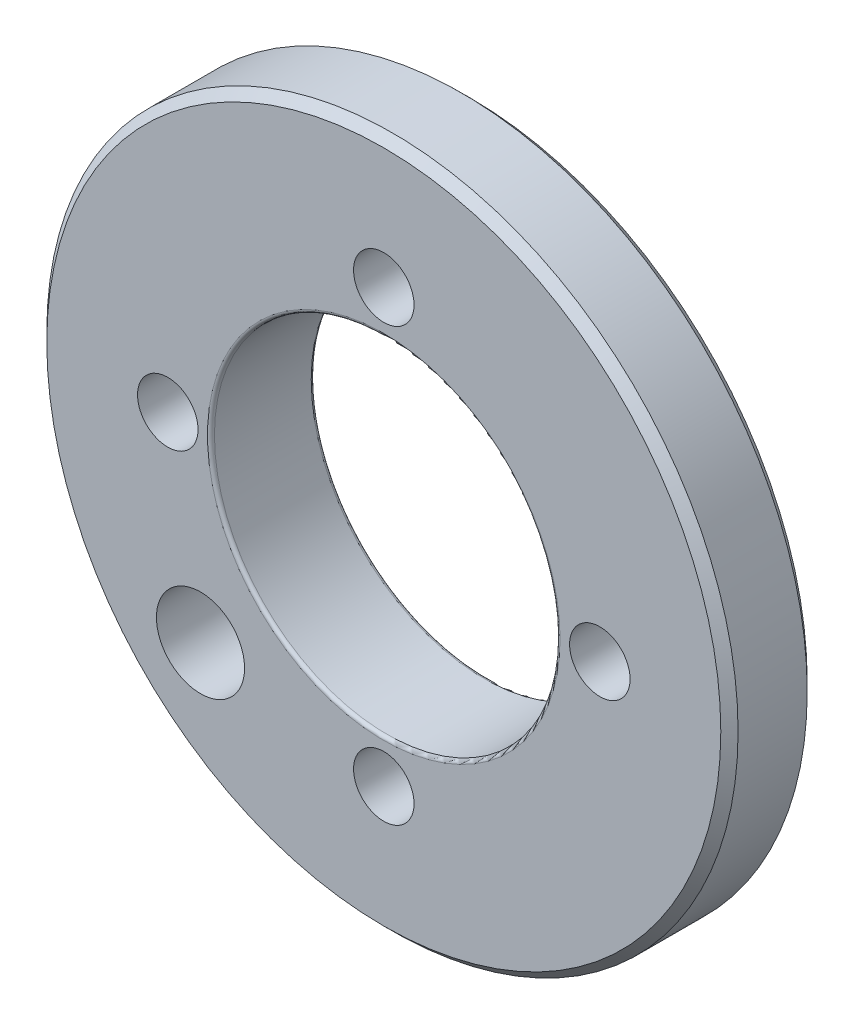
from build123d import *

# Parameters (mm, degrees)
SKETCH1_R           = 16.5
SKETCH1_R_2         = 9.5
SKETCH1_R_3         = 1.75
BOSS_EXTRUDE1_DEPTH = 6
SKETCH2_R           = 2.8
CUT_EXTRUDE1_DEPTH  = 3
BOSS_EXTRUDE2_START = -5
SKETCH3_R           = 20
SKETCH3_R_2         = 1.75
SKETCH3_R_3         = 2.8
BOSS_EXTRUDE2_DEPTH = 5
SKETCH6_R           = 2.55
CUT_EXTRUDE3_DEPTH  = 5
SKETCH7_R           = 10
CUT_EXTRUDE4_DEPTH  = 29.91366459
FILLET1_R           = 0.2
CHAMFER1_SIZE       = 0.5


with BuildPart() as part:
    # Sketch1 → Boss-Extrude1 (new body)
    with BuildSketch(Plane.XY):
        Circle(SKETCH1_R)
        Circle(SKETCH1_R_2, mode=Mode.SUBTRACT)
        with Locations((12.5, 0)):
            Circle(SKETCH1_R_3, mode=Mode.SUBTRACT)
        with Locations((0, -12.5)):
            Circle(SKETCH1_R_3, mode=Mode.SUBTRACT)
        with Locations((-12.5, 0)):
            Circle(SKETCH1_R_3, mode=Mode.SUBTRACT)
        with Locations((0, 12.5)):
            Circle(SKETCH1_R_3, mode=Mode.SUBTRACT)
    extrude(amount=BOSS_EXTRUDE1_DEPTH)

    # Sketch2 → Cut-Extrude1 (cut)
    with BuildSketch(Plane.XY.offset(6)):
        with Locations((12.5, 0)):
            Circle(SKETCH2_R)
    extrude(amount=-CUT_EXTRUDE1_DEPTH, mode=Mode.SUBTRACT)

    # Sketch3 → Boss-Extrude2 (add)
    with BuildSketch(Plane.XY.offset(6).offset(BOSS_EXTRUDE2_START)):
        Circle(SKETCH3_R)
        with Locations((12.5, 0)):
            Circle(SKETCH3_R_2, mode=Mode.SUBTRACT)
        with Locations((0, -12.5)):
            Circle(SKETCH3_R_3, mode=Mode.SUBTRACT)
        with Locations((-12.5, 0)):
            Circle(SKETCH3_R_3, mode=Mode.SUBTRACT)
        with Locations((0, 12.5)):
            Circle(SKETCH3_R_3, mode=Mode.SUBTRACT)
    extrude(amount=BOSS_EXTRUDE2_DEPTH)

    # Sketch6 → Cut-Extrude3 (cut)
    with BuildSketch(Plane.XY.offset(6)):
        with Locations((-10.606601718, -10.606601718)):
            Circle(SKETCH6_R)
    extrude(amount=-CUT_EXTRUDE3_DEPTH, mode=Mode.SUBTRACT)

    # Sketch7 → Cut-Extrude4 (cut, through all)
    with BuildSketch(Plane.XY.offset(6)):
        Circle(SKETCH7_R)
    extrude(amount=-CUT_EXTRUDE4_DEPTH, mode=Mode.SUBTRACT)

    # Fillet1
    fillet1_edges = [part.edges().sort_by_distance(p)[0] for p in [
        (-10, 0, 0),
        (-10, 0, 6),
    ]]
    fillet(fillet1_edges, radius=FILLET1_R)

    # Chamfer1
    chamfer1_edges = [part.edges().sort_by_distance(p)[0] for p in [
        (-20, 0, 6),
        (-20, 0, 1),
    ]]
    chamfer(chamfer1_edges, length=CHAMFER1_SIZE)


solid = part.part
